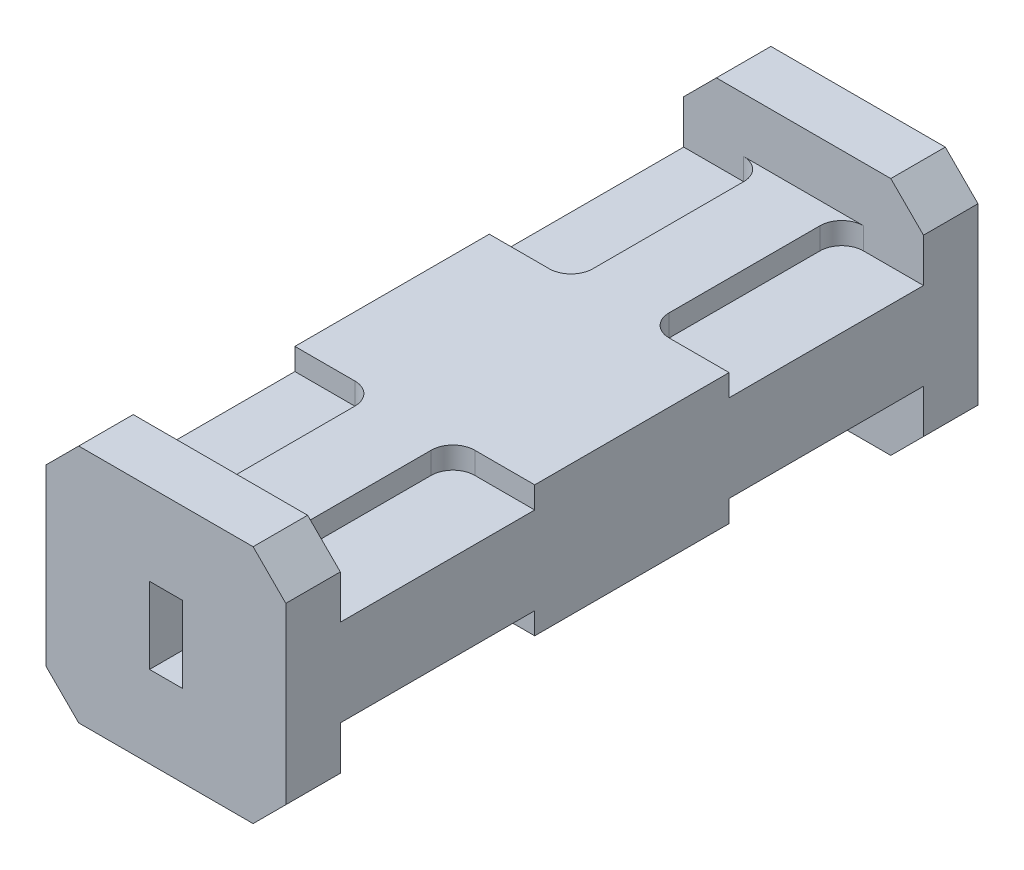
from build123d import *

# Parameters (mm, degrees)
SKETCH1_W           = 22
SKETCH1_H           = 22
BOSS_EXTRUDE1_DEPTH = 63.5
CUT_EXTRUDE1_DEPTH  = 71.712445864
SKETCH3_W           = 3
SKETCH3_H           = 7
CUT_EXTRUDE2_DEPTH  = 71.712445864
BOSS_EXTRUDE2_REACH = 68.259
SKETCH4_W           = 7
SKETCH4_H           = 2
FILLET1_R           = 2
CHAMFER1_SIZE       = 3


with BuildPart() as part:
    # Sketch1 → Boss-Extrude1 (new body)
    with BuildSketch(Plane.XY):
        with Locations((11, 11)):
            Rectangle(SKETCH1_W, SKETCH1_H)
    extrude(amount=-BOSS_EXTRUDE1_DEPTH)

    # Sketch2 → Cut-Extrude1 (cut, through all)
    with BuildSketch(Plane(origin=(22, 0, 0), x_dir=(0, 0, -1), z_dir=(1, 0, 0))):
        Polygon((5, 22), (5, 15), (22.833333333, 15), (22.833333333, 17), (40.666666667, 17), (40.666666667, 15), (58.5, 15), (58.5, 22), align=None)
        Polygon((22.833333333, 7), (22.833333333, 5), (40.666666667, 5), (40.666666667, 7), (58.5, 7), (58.5, 0), (5, 0), (5, 7), align=None)
    extrude(amount=-CUT_EXTRUDE1_DEPTH, mode=Mode.SUBTRACT)

    # Sketch3 → Cut-Extrude2 (cut, through all)
    with BuildSketch(Plane.XY):
        with Locations((11, 11)):
            Rectangle(SKETCH3_W, SKETCH3_H)
    extrude(amount=-CUT_EXTRUDE2_DEPTH, mode=Mode.SUBTRACT)

    # Boss-Extrude2: up to this face of the body (flat: up to its plane)
    boss_extrude2_end = Plane(part.part.faces().sort_by_distance((11, 18.5, -58.5))[0])
    # Sketch4 → Boss-Extrude2 (add, up to the picked face)
    with BuildSketch(Plane(origin=(0, 0, -5), x_dir=(-1, 0, 0), z_dir=(0, 0, -1)), mode=Mode.PRIVATE) as boss_extrude2_sk1:
        with Locations((-11, 16)):
            Rectangle(SKETCH4_W, SKETCH4_H)
    boss_extrude2_tool1 = split(extrude(boss_extrude2_sk1.sketch, amount=BOSS_EXTRUDE2_REACH, mode=Mode.PRIVATE), bisect_by=boss_extrude2_end, keep=Keep.BOTH, mode=Mode.PRIVATE)
    boss_extrude2 = boss_extrude2_tool1.solids().sort_by(Axis((11, 16, -5), (0, 0, -1)))[0]
    add(boss_extrude2)

    # Mirror1: Boss-Extrude2 across plane
    add(boss_extrude2.mirror(Plane.ZX.offset(11)))

    # Fillet1
    fillet1_edges = [part.edges().sort_by_distance(p)[0] for p in [
        (7.5, 16, -40.666666667),
        (7.5, 16, -22.833333333),
        (7.5, 16, -5),
        (14.5, 16, -40.666666667),
        (14.5, 16, -22.833333333),
        (14.5, 16, -5),
        (7.5, 16, -58.5),
        (14.5, 16, -58.5),
        (14.5, 6, -58.5),
        (7.5, 6, -58.5),
        (7.5, 6, -5),
        (14.5, 6, -5),
        (14.5, 6, -22.833333333),
        (14.5, 6, -40.666666667),
        (7.5, 6, -22.833333333),
        (7.5, 6, -40.666666667),
    ]]
    fillet(fillet1_edges, radius=FILLET1_R)

    # Chamfer1
    chamfer1_edges = [part.edges().sort_by_distance(p)[0] for p in [
        (0, 0, -2.5),
        (22, 0, -2.5),
        (22, 22, -2.5),
        (0, 22, -2.5),
        (0, 22, -61),
        (22, 22, -61),
        (22, 0, -61),
        (0, 0, -61),
    ]]
    chamfer(chamfer1_edges, length=CHAMFER1_SIZE)


solid = part.part
